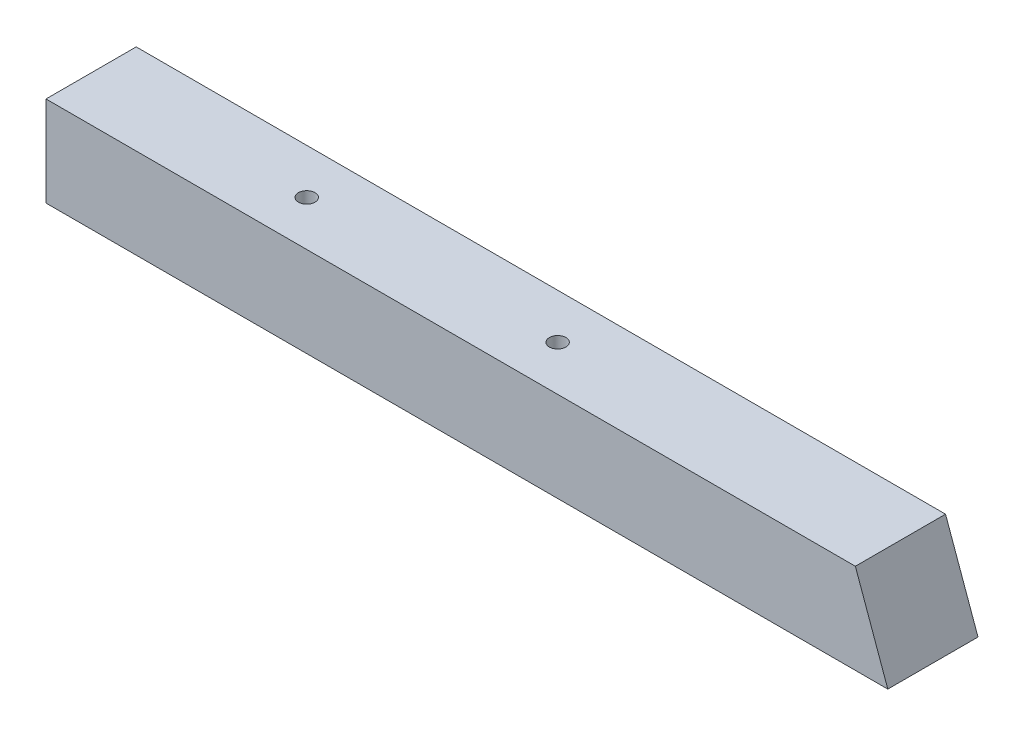
from build123d import *

# Parameters (mm, degrees)
SKETCH1_W               = 38.1
SKETCH1_H               = 38.1
BOSS_EXTRUDE1_DEPTH     = 355.6
CUT_EXTRUDE1_DEPTH      = 359.142251766
CUT_EXTRUDE2_DEPTH      = 359.142251766
CUT_EXTRUDE2_DEPTH_BACK = 359.142251766
SKETCH3_R               = 3.5


with BuildPart() as part:
    # Sketch1 → Boss-Extrude1 (new body)
    with BuildSketch(Plane(origin=(0, 0, 0), x_dir=(0, 0, -1), z_dir=(1, 0, 0))):
        Rectangle(SKETCH1_W, SKETCH1_H)
    extrude(amount=BOSS_EXTRUDE1_DEPTH)

    # Sketch2 → Cut-Extrude1 (cut, through all)
    with BuildSketch(Plane.XY.offset(19.05)):
        Polygon((355.6, -19.05), (341.890667107, 19.05), (355.6, 19.05), align=None)
    extrude(amount=-CUT_EXTRUDE1_DEPTH, mode=Mode.SUBTRACT)

    # Sketch3 → Cut-Extrude2 (cut, two sides: drawn at the far end of the back side and taken through both)
    with BuildSketch(Plane(origin=(0, -19.05, 0), x_dir=(-1, 0, 0), z_dir=(0, -1, 0)).offset(-CUT_EXTRUDE2_DEPTH_BACK)):
        with Locations(Location((-91.088392372, 0, 0), (0, 0, 90))):
            Circle(SKETCH3_R)
        with Locations(Location((-197.087368962, 0, 0), (0, 0, 90))):
            Circle(SKETCH3_R)
    extrude(amount=CUT_EXTRUDE2_DEPTH + CUT_EXTRUDE2_DEPTH_BACK, mode=Mode.SUBTRACT)


solid = part.part
